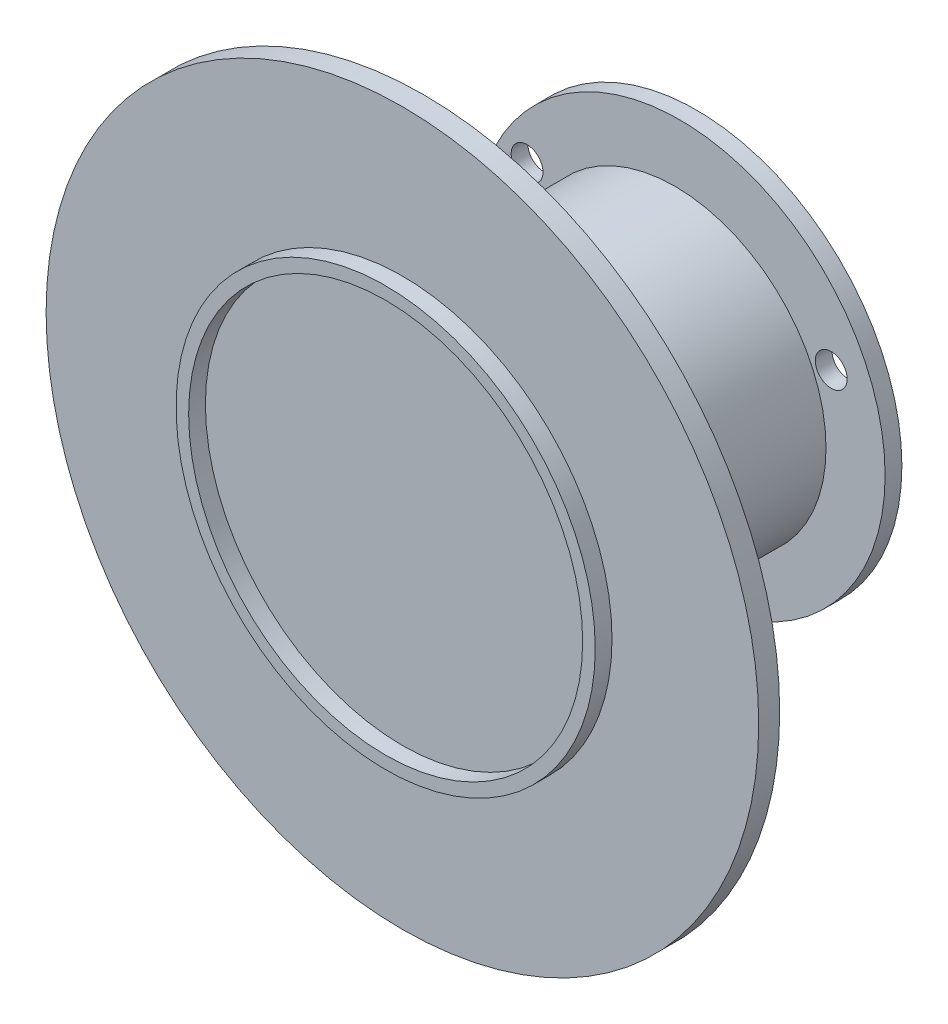
from build123d import *

# Parameters (mm, degrees)
SKETCH_1_R          = 24.5
EXTRUDE_3_DEPTH     = 2
SKETCH_3_R          = 1.9
CUT_EXTRUDE_1_DEPTH = 3
SKETCH_4_R          = 18.026762753
EXTRUDE_4_DEPTH     = 30
SKETCH_5_R          = 42.5
EXTRUDE_6_DEPTH     = 2.5
SKETCH_6_R          = 25
SKETCH_6_R_2        = 23.5
EXTRUDE_7_DEPTH     = 2


with BuildPart() as part:
    # 스케치1 → 보스-돌출3 (new body)
    with BuildSketch(Plane.XY):
        with Locations((4.325882057, 117.219920175)):
            Circle(SKETCH_1_R)
    extrude(amount=EXTRUDE_3_DEPTH)

    # 스케치3 → 컷-돌출1 (cut)
    with BuildSketch(Plane.XY.offset(2)):
        with Locations((1.179008368, 95.896439246)):
            Circle(SKETCH_3_R)
        with Locations((22.395703109, 124.906718796)):
            Circle(SKETCH_3_R)
        with Locations((-13.882118572, 128.141421182)):
            Circle(SKETCH_3_R)
    extrude(amount=-CUT_EXTRUDE_1_DEPTH, mode=Mode.SUBTRACT)

    # 스케치4 → 보스-돌출4 (add)
    with BuildSketch(Plane.XY.offset(2)):
        with Locations((3.749565529, 116.53268792)):
            Circle(SKETCH_4_R)
    extrude(amount=EXTRUDE_4_DEPTH)

    # 스케치5 → 보스-돌출6 (add)
    with BuildSketch(Plane.XY.offset(32)):
        with Locations((3.749565529, 116.53268792)):
            Circle(SKETCH_5_R)
    extrude(amount=EXTRUDE_6_DEPTH)

    # 스케치6 → 보스-돌출7 (add)
    with BuildSketch(Plane.XY.offset(34.5)):
        with Locations((3.749565529, 116.53268792)):
            Circle(SKETCH_6_R)
        with Locations((3.749565529, 116.53268792)):
            Circle(SKETCH_6_R_2, mode=Mode.SUBTRACT)
    extrude(amount=EXTRUDE_7_DEPTH)


solid = part.part
